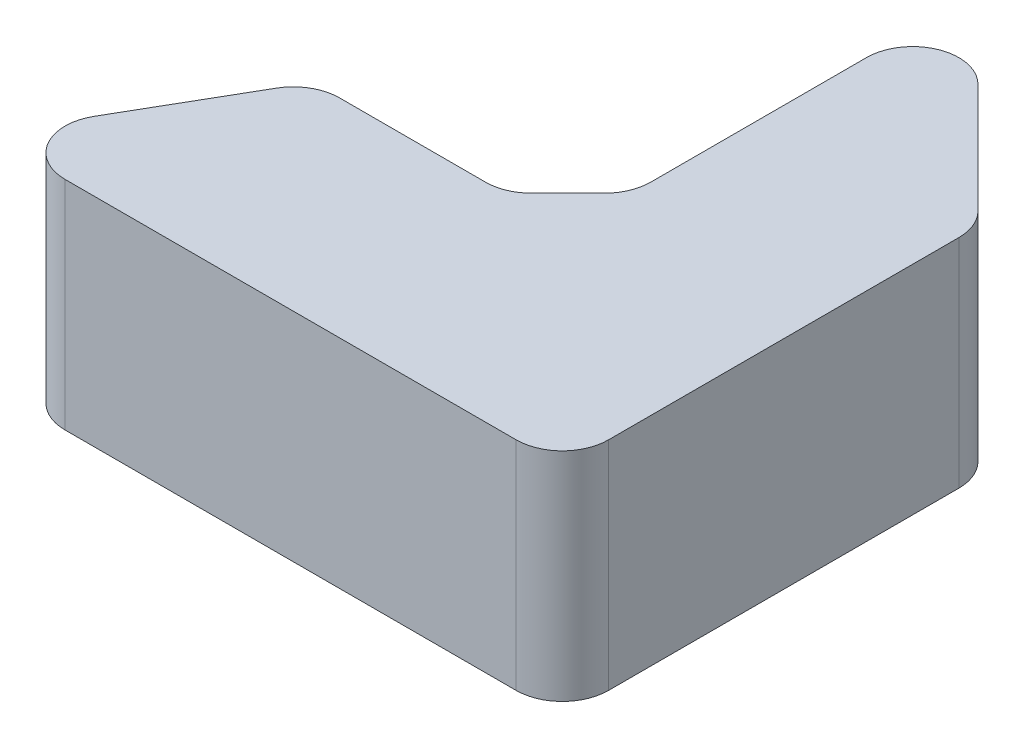
from build123d import *

# Parameters (mm, degrees)
BOSS_EXTRUDE1_DEPTH = 18.8
FILLET1_R           = 4


with BuildPart() as part:
    # Sketch1 → Boss-Extrude1 (new body)
    with BuildSketch(Plane(origin=(0, 0, 0), x_dir=(1, 0, 0), z_dir=(0, 1, 0))):
        Polygon((0, 0), (50, 0), (50, 36), (32.5, 53.5), (32.5, 23.5), (27, 18), (10.392304845, 18), align=None)
    extrude(amount=BOSS_EXTRUDE1_DEPTH)

    # Fillet1
    fillet1_edges = [part.edges().sort_by_distance(p)[0] for p in [
        (10.392304845, 9.4, -18),
        (27, 9.4, -18),
        (32.5, 9.4, -23.5),
        (32.5, 9.4, -53.5),
        (50, 9.4, -36),
        (50, 9.4, 0),
        (0, 9.4, 0),
    ]]
    fillet(fillet1_edges, radius=FILLET1_R)


solid = part.part
